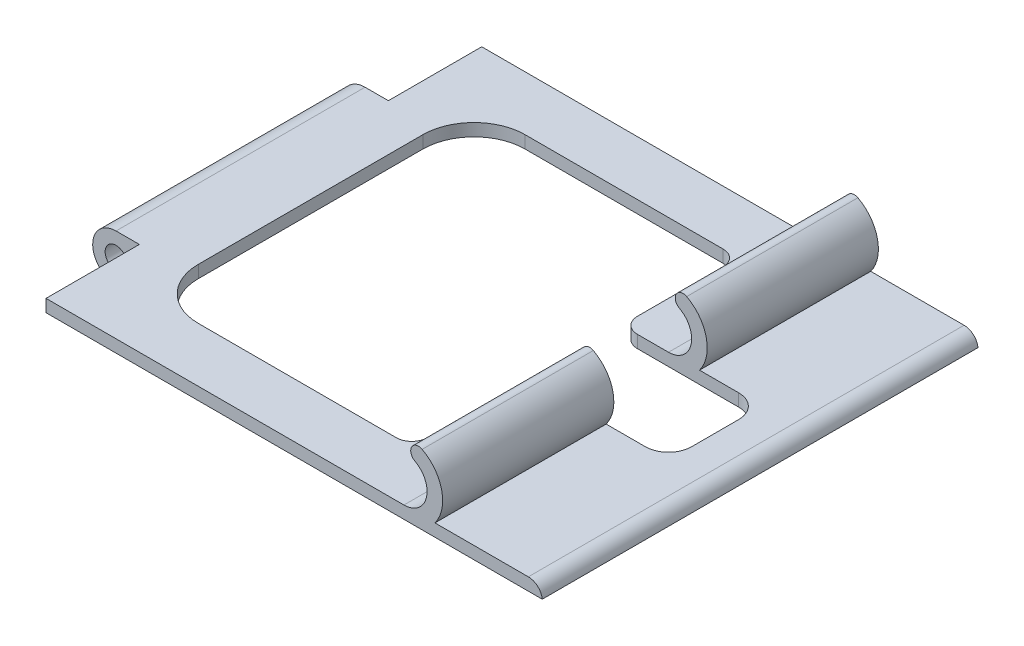
from build123d import *

# Parameters (mm, degrees)
SKETCH_1_R               = 3.5
EXTRUDE_1_DEPTH          = 140
SKETCH_2_W               = 30
SKETCH_2_H               = 27.344925094
CUT_EXTRUDE_1_DEPTH      = 214.393529953
CUT_EXTRUDE_3_DEPTH      = 214.005050566
CUT_EXTRUDE_3_DEPTH_BACK = 214.005050566


with BuildPart() as part:
    # 草图1 → 凸台-拉伸1 (new body)
    with BuildSketch(Plane.XY):
        with BuildLine():
            Line((154.968701019, 4), (124.968701019, 4))
            ThreePointArc((124.968701019, 4), (127.137930645, 14.150809034), (120.852941176, 22.411764706))
            ThreePointArc((120.852941176, 22.411764706), (117.470588235, 21.382352941), (118.5, 18))
            ThreePointArc((118.5, 18), (122.215434845, 9.633641289), (115, 4))
            Line((115, 4), (0, 4))
            Line((0, 4), (-7.5, 4))
            ThreePointArc((-7.5, 4), (-11.372983346, -9.922616289), (-0.866750419, 0))
            Line((-0.866750419, 0), (0, 0))
            Line((0, 0), (115, 0))
            Line((115, 0), (159.440401192, 0))
            ThreePointArc((159.440401192, 0), (157.968538616, 2.854080771), (154.968701019, 4))
        make_face()
        with Locations((-7.5, -3.5)):
            Circle(SKETCH_1_R, mode=Mode.SUBTRACT)
    extrude(amount=-EXTRUDE_1_DEPTH)

    # 草图2 → 切除-拉伸1 (cut, through all)
    with BuildSketch(Plane(origin=(0, 0, 0), x_dir=(0, 0, -1), z_dir=(1, 0, 0))):
        with Locations((15, -2.172462547)):
            Rectangle(SKETCH_2_W, SKETCH_2_H)
        with Locations((125, -2.172462547)):
            Rectangle(SKETCH_2_W, SKETCH_2_H)
    extrude(amount=-CUT_EXTRUDE_1_DEPTH, mode=Mode.SUBTRACT)

    # 草图3 → 切除-拉伸3 (cut, two sides: drawn at the far end of the back side and taken through both)
    with BuildSketch(Plane(origin=(0, 4, 0), x_dir=(1, 0, 0), z_dir=(0, 1, 0)).offset(-CUT_EXTRUDE_3_DEPTH_BACK)):
        with BuildLine():
            Line((15, 106.057196128), (15, 33.942803872))
            ThreePointArc((15, 33.942803872), (19.815985752, 22.315985752), (31.442803872, 17.5))
            Line((31.442803872, 17.5), (95.059923468, 17.5))
            ThreePointArc((95.059923468, 17.5), (98.553085083, 18.946914917), (100, 22.440076532))
            Line((100, 22.440076532), (100, 50))
            ThreePointArc((100, 50), (101.464466094, 53.535533906), (105, 55))
            Line((105, 55), (115, 55))
            Line((115, 55), (137.57175482, 55))
            ThreePointArc((137.57175482, 55), (142.824317359, 57.175682641), (145, 62.42824518))
            Line((145, 62.42824518), (145, 77.57175482))
            ThreePointArc((145, 77.57175482), (142.824317359, 82.824317359), (137.57175482, 85))
            Line((137.57175482, 85), (115, 85))
            Line((115, 85), (105, 85))
            ThreePointArc((105, 85), (101.464466094, 86.464466094), (100, 90))
            Line((100, 90), (100, 117.559923468))
            ThreePointArc((100, 117.559923468), (98.553085083, 121.053085083), (95.059923468, 122.5))
            Line((95.059923468, 122.5), (31.442803872, 122.5))
            ThreePointArc((31.442803872, 122.5), (19.815985752, 117.684014248), (15, 106.057196128))
        make_face()
    extrude(amount=CUT_EXTRUDE_3_DEPTH + CUT_EXTRUDE_3_DEPTH_BACK, mode=Mode.SUBTRACT)


solid = part.part
